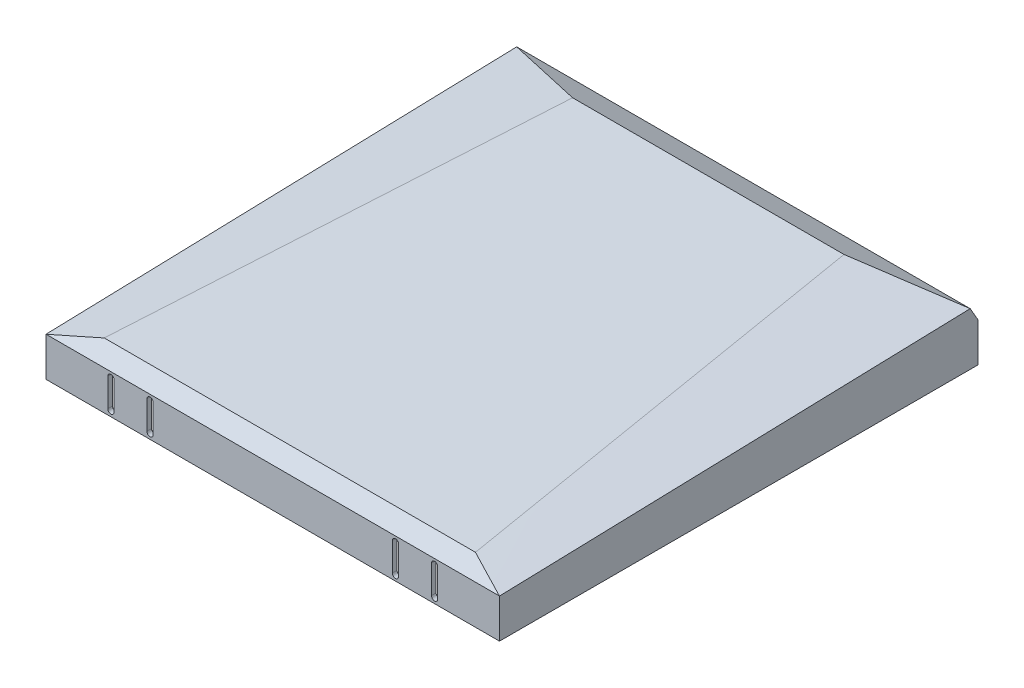
from build123d import *

# Parameters (mm, degrees)
EXTRUDE_1_DEPTH     = 145
CUT_EXTRUDE_1_DEPTH = 150
CUT_EXTRUDE_2_DEPTH = 150
SHELL_1_T           = 3
CUT_EXTRUDE_4_DEPTH = 3
SKETCH_13_W         = 284
SKETCH_13_H         = 300
CUT_EXTRUDE_5_DEPTH = 3
CUT_EXTRUDE_6_DEPTH = 3


with BuildPart() as part:
    # 草图4 → 凸台-拉伸1 (new, symmetric)
    with BuildSketch(Plane(origin=(0, 0, 0), x_dir=(0, 0, -1), z_dir=(1, 0, 0))):
        Polygon((-148.47826087, 0), (157.52173913, 0), (157.52173913, 25), (145.02173913, 46.650635095), (-148.47826087, 30), align=None)
    extrude(amount=EXTRUDE_1_DEPTH, both=True)

    # 草图5 → 切除-放样1 section 0
    with BuildSketch(Plane(origin=(0, 74.458913868, -128.966621895), x_dir=(-1, 0, 0), z_dir=(0, 0.500000000000004, -0.8660254037844364))):
        with BuildLine():
            Line((-145, -47.110234471), (-85, -32.110234471))
            Line((-85, -32.110234471), (-145, -32.110234471))
            Line((-145, -32.110234471), (-145, -47.110234471))
        make_face()
    # 草图6 → 切除-放样1 section 1
    with BuildSketch(Plane.XY.offset(148.47826087)):
        with BuildLine():
            Line((145, 30), (120, 30))
            Line((120, 30), (145, 25))
            Line((145, 25), (145, 30))
        make_face()
    loft(mode=Mode.SUBTRACT)

    # 草图7 → 切除-放样2 section 0
    with BuildSketch(Plane(origin=(0, 74.458913868, -128.966621895), x_dir=(-1, 0, 0), z_dir=(0, 0.500000000000004, -0.8660254037844364))):
        with BuildLine():
            Line((145, -32.110234471), (85, -32.110234471))
            Line((85, -32.110234471), (145, -47.110234471))
            Line((145, -47.110234471), (145, -32.110234471))
        make_face()
    # 草图8 → 切除-放样2 section 1
    with BuildSketch(Plane.XY.offset(148.47826087)):
        with BuildLine():
            Line((-120, 30), (-145, 30))
            Line((-145, 30), (-145, 25))
            Line((-145, 25), (-120, 30))
        make_face()
    loft(mode=Mode.SUBTRACT)

    # 草图9 → 切除-拉伸1 (cut, symmetric)
    with BuildSketch(Plane(origin=(0, 0, 0), x_dir=(0, 0, -1), z_dir=(1, 0, 0))):
        Polygon((-148.47826087, 25), (-137.542379964, 30.620406686), (-148.47826087, 30), align=None)
    extrude(amount=CUT_EXTRUDE_1_DEPTH, both=True, mode=Mode.SUBTRACT)

    # 草图10 → 切除-拉伸2 (cut, symmetric)
    with BuildSketch(Plane(origin=(0, 0, 0), x_dir=(0, 0, -1), z_dir=(1, 0, 0))):
        Polygon((152.52173913, 33.660254038), (130.045819319, 45.801031769), (145.02173913, 46.650635095), align=None)
    extrude(amount=CUT_EXTRUDE_2_DEPTH, both=True, mode=Mode.SUBTRACT)

    # 抽壳1 (no face opened: a closed hollow body)
    add(offset(amount=-SHELL_1_T, mode=Mode.PRIVATE), mode=Mode.SUBTRACT)

    # 草图12 → 切除-拉伸4 (cut)
    with BuildSketch(Plane.XY.offset(148.47826087)):
        with BuildLine():
            Line((-76.5, 21.5), (-76.5, 3.5))
            ThreePointArc((-76.5, 3.5), (-78.5, 1.5), (-80.5, 3.5))
            Line((-80.5, 3.5), (-80.5, 21.5))
            ThreePointArc((-80.5, 21.5), (-78.5, 23.5), (-76.5, 21.5))
        make_face()
        with BuildLine():
            Line((-101.5, 21.5), (-101.5, 3.5))
            ThreePointArc((-101.5, 3.5), (-103.5, 1.5), (-105.5, 3.5))
            Line((-105.5, 3.5), (-105.5, 21.5))
            ThreePointArc((-105.5, 21.5), (-103.5, 23.5), (-101.5, 21.5))
        make_face()
        with BuildLine():
            Line((76.5, 21.5), (76.5, 3.5))
            ThreePointArc((76.5, 3.5), (78.5, 1.5), (80.5, 3.5))
            Line((80.5, 3.5), (80.5, 21.5))
            ThreePointArc((80.5, 21.5), (78.5, 23.5), (76.5, 21.5))
        make_face()
        with BuildLine():
            Line((101.5, 21.5), (101.5, 3.5))
            ThreePointArc((101.5, 3.5), (103.5, 1.5), (105.5, 3.5))
            Line((105.5, 3.5), (105.5, 21.5))
            ThreePointArc((105.5, 21.5), (103.5, 23.5), (101.5, 21.5))
        make_face()
    extrude(amount=-CUT_EXTRUDE_4_DEPTH, mode=Mode.SUBTRACT)

    # 草图13 → 切除-拉伸5 (cut)
    with BuildSketch(Plane.XZ):
        with Locations((0, -4.52173913)):
            Rectangle(SKETCH_13_W, SKETCH_13_H)
    extrude(amount=-CUT_EXTRUDE_5_DEPTH, mode=Mode.SUBTRACT)

    # 草图14 → 切除-拉伸6 (cut)
    with BuildSketch(Plane(origin=(0, 0, -157.52173913), x_dir=(-1, 0, 0), z_dir=(0, 0, -1))):
        with BuildLine():
            Line((-46.5, 19.5), (-46.5, 4.5))
            ThreePointArc((-46.5, 4.5), (-49, 2), (-51.5, 4.5))
            Line((-51.5, 4.5), (-51.5, 19.5))
            ThreePointArc((-51.5, 19.5), (-49, 22), (-46.5, 19.5))
        make_face()
        with BuildLine():
            Line((-82.454286499, 19.5), (-82.454286499, 4.5))
            ThreePointArc((-82.454286499, 4.5), (-85, 1.954286499), (-87.545713501, 4.5))
            Line((-87.545713501, 4.5), (-87.545713501, 19.5))
            ThreePointArc((-87.545713501, 19.5), (-85, 22.045713501), (-82.454286499, 19.5))
        make_face()
        with BuildLine():
            Line((46.5, 19.5), (46.5, 4.5))
            ThreePointArc((46.5, 4.5), (49, 2), (51.5, 4.5))
            Line((51.5, 4.5), (51.5, 19.5))
            ThreePointArc((51.5, 19.5), (49, 22), (46.5, 19.5))
        make_face()
        with BuildLine():
            Line((82.454286499, 19.5), (82.454286499, 4.5))
            ThreePointArc((82.454286499, 4.5), (85, 1.954286499), (87.545713501, 4.5))
            Line((87.545713501, 4.5), (87.545713501, 19.5))
            ThreePointArc((87.545713501, 19.5), (85, 22.045713501), (82.454286499, 19.5))
        make_face()
    extrude(amount=-CUT_EXTRUDE_6_DEPTH, mode=Mode.SUBTRACT)


solid = part.part
